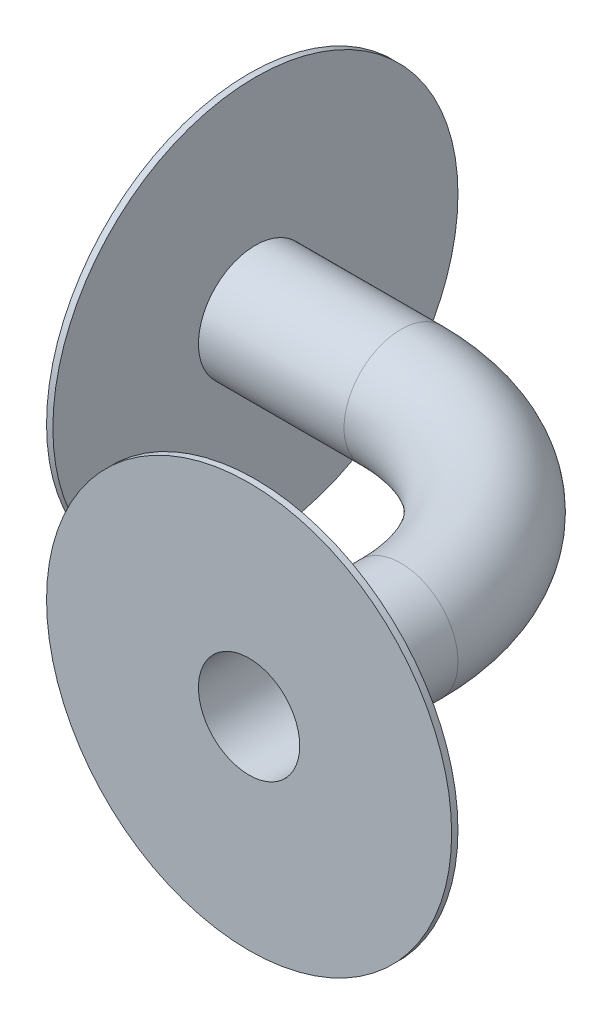
from build123d import *

# Parameters (mm, degrees)
SKETCH1_R           = 14.2875
SKETCH1_R_2         = 12.7
REVOLVE1_ANGLE      = 90
SKETCH2_R           = 14.2875
SKETCH2_R_2         = 12.7
BOSS_EXTRUDE1_DEPTH = 38.1
SKETCH3_R           = 14.2875
SKETCH3_R_2         = 12.7
BOSS_EXTRUDE2_DEPTH = 38.1
BOSS_EXTRUDE3_START = -1.5875
SKETCH4_R           = 50.8
SKETCH4_R_2         = 12.7
BOSS_EXTRUDE3_DEPTH = 1.5875
BOSS_EXTRUDE4_START = -1.5875
SKETCH5_R           = 50.8
SKETCH5_R_2         = 12.7
BOSS_EXTRUDE4_DEPTH = 1.5875


with BuildPart() as part:
    # Sketch1 → Revolve1 (revolve)
    with BuildSketch(Plane(origin=(0, 0, 0), x_dir=(0, 0, -1), z_dir=(1, 0, 0))):
        Circle(SKETCH1_R)
        Circle(SKETCH1_R_2, mode=Mode.SUBTRACT)
    revolve(axis=Axis((0, 0, 50.8), (0, -1, 0)), revolution_arc=REVOLVE1_ANGLE)

    # Sketch2 → Boss-Extrude1 (add)
    with BuildSketch(Plane.XY.offset(50.8)):
        with Locations((50.8, 0)):
            Circle(SKETCH2_R)
        with Locations((50.8, 0)):
            Circle(SKETCH2_R_2, mode=Mode.SUBTRACT)
    extrude(amount=BOSS_EXTRUDE1_DEPTH)

    # Sketch3 → Boss-Extrude2 (add)
    with BuildSketch(Plane.ZY):
        with Locations(Location((0, 0, 0), (0, 0, 180))):
            Circle(SKETCH3_R)
        with Locations(Location((0, 0, 0), (0, 0, 180))):
            Circle(SKETCH3_R_2, mode=Mode.SUBTRACT)
    extrude(amount=BOSS_EXTRUDE2_DEPTH)

    # Sketch4 → Boss-Extrude3 (add)
    with BuildSketch(Plane.ZY.offset(38.1).offset(BOSS_EXTRUDE3_START)):
        Circle(SKETCH4_R)
        with Locations(Location((0, 0, 0), (0, 0, 180))):
            Circle(SKETCH4_R_2, mode=Mode.SUBTRACT)
    extrude(amount=BOSS_EXTRUDE3_DEPTH)

    # Sketch5 → Boss-Extrude4 (add)
    with BuildSketch(Plane.XY.offset(88.9).offset(BOSS_EXTRUDE4_START)):
        with Locations((50.8, 0)):
            Circle(SKETCH5_R)
        with Locations((50.8, 0)):
            Circle(SKETCH5_R_2, mode=Mode.SUBTRACT)
    extrude(amount=BOSS_EXTRUDE4_DEPTH)


solid = part.part
